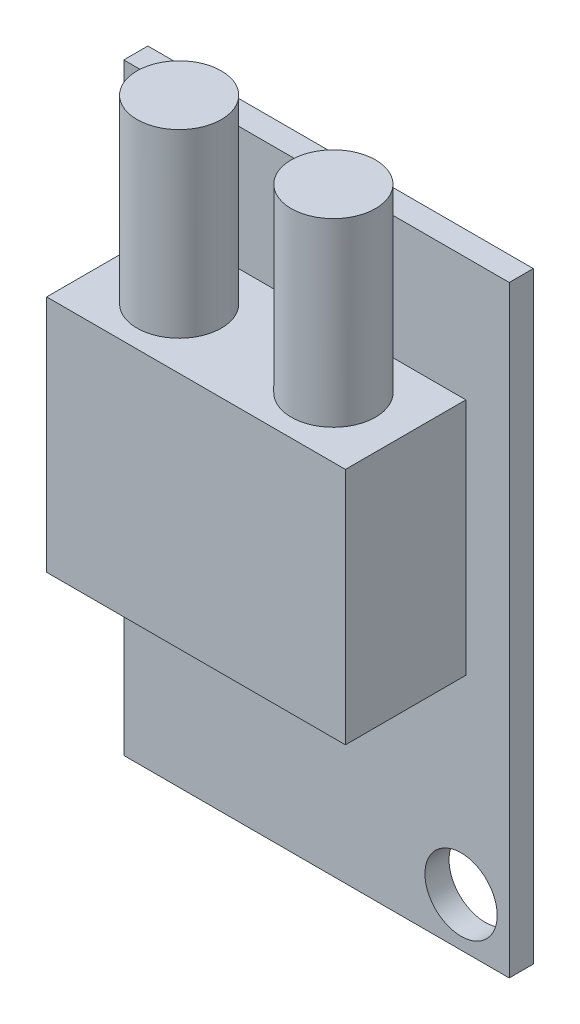
from build123d import *

# Parameters (mm, degrees)
SKETCH1_W           = 16
SKETCH1_H           = 25
BOSS_EXTRUDE1_DEPTH = 1
SKETCH2_R           = 1.5
CUT_EXTRUDE1_DEPTH  = 1
SKETCH3_W           = 12.4
SKETCH3_H           = 9.9
BOSS_EXTRUDE2_DEPTH = 5
SKETCH4_R           = 1.75
BOSS_EXTRUDE3_DEPTH = 7.5


with BuildPart() as part:
    # Sketch1 → Boss-Extrude1 (new body)
    with BuildSketch(Plane.XY):
        with Locations((8, 12.5)):
            Rectangle(SKETCH1_W, SKETCH1_H)
    extrude(amount=BOSS_EXTRUDE1_DEPTH)

    # Sketch2 → Cut-Extrude1 (cut)
    with BuildSketch(Plane.XY.offset(1)):
        with Locations((2, 23)):
            Circle(SKETCH2_R)
        with Locations((14, 2)):
            Circle(SKETCH2_R)
    extrude(amount=-CUT_EXTRUDE1_DEPTH, mode=Mode.SUBTRACT)

    # Sketch3 → Boss-Extrude2 (add)
    with BuildSketch(Plane.XY.offset(1)):
        with Locations((8, 14.931642479)):
            Rectangle(SKETCH3_W, SKETCH3_H)
    extrude(amount=BOSS_EXTRUDE2_DEPTH)

    # Sketch4 → Boss-Extrude3 (add)
    with BuildSketch(Plane(origin=(0, 19.881642479, 0), x_dir=(1, 0, 0), z_dir=(0, 1, 0))):
        with Locations(Location((4.8, -3.5, 0), (0, 0, 90))):
            Circle(SKETCH4_R)
        with Locations(Location((11.2, -3.5, 0), (0, 0, 90))):
            Circle(SKETCH4_R)
    extrude(amount=BOSS_EXTRUDE3_DEPTH)


solid = part.part
